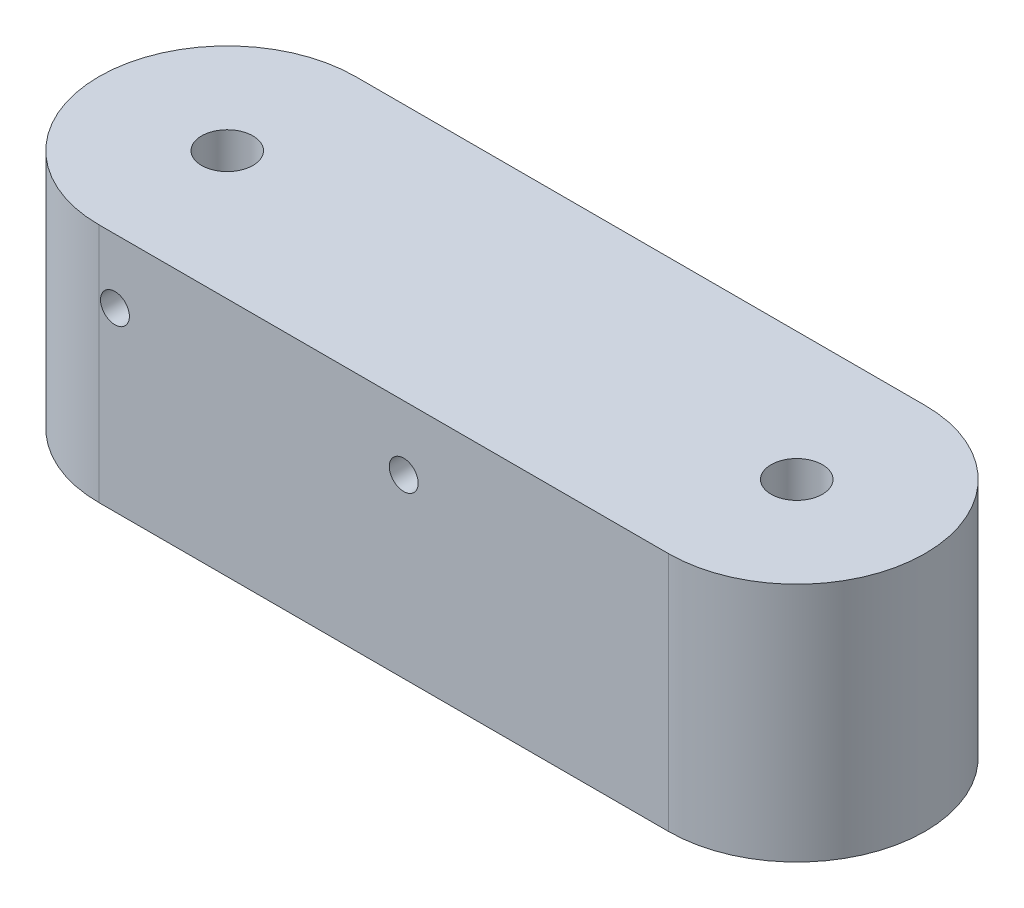
from build123d import *

# Parameters (mm, degrees)
SKETCH_1_R          = 1.6
EXTRUDE_1_DEPTH     = 15
SKETCH_2_R          = 0.9
CUT_EXTRUDE_1_DEPTH = 49.716013794


with BuildPart() as part:
    # 草图1 → 凸台-拉伸1 (new body)
    with BuildSketch(Plane(origin=(0, 0, 0), x_dir=(1, 0, 0), z_dir=(0, 1, 0))):
        with BuildLine():
            Line((0, 8), (35.5, 8))
            ThreePointArc((35.5, 8), (43.5, 0), (35.5, -8))
            Line((35.5, -8), (0, -8))
            ThreePointArc((0, -8), (-8, 0), (0, 8))
        make_face()
        with Locations(Location((35.5, 0, 0), (0, 0, 270))):
            Circle(SKETCH_1_R, mode=Mode.SUBTRACT)
        with Locations(Location((0, 0, 0), (0, 0, 270))):
            Circle(SKETCH_1_R, mode=Mode.SUBTRACT)
    extrude(amount=EXTRUDE_1_DEPTH)

    # 草图2 → 切除-拉伸1 (cut, through all)
    with BuildSketch(Plane.XY.offset(8)):
        with Locations((19, 11)):
            Circle(SKETCH_2_R)
        with Locations((1, 11)):
            Circle(SKETCH_2_R)
    extrude(amount=-CUT_EXTRUDE_1_DEPTH, mode=Mode.SUBTRACT)


solid = part.part
